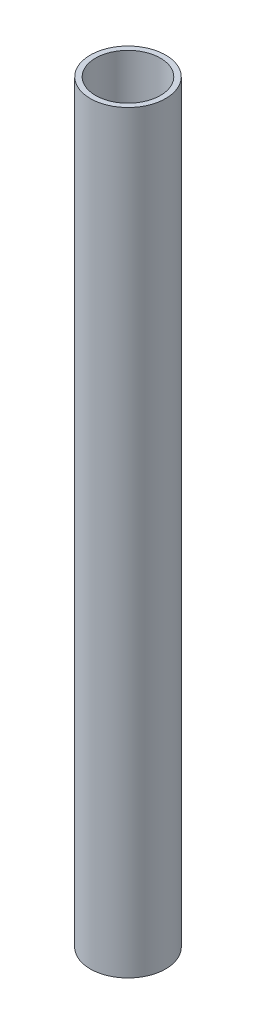
from build123d import *

# Parameters (mm, degrees)
SKETCH1_R           = 6.35
BOSS_EXTRUDE1_DEPTH = 127
SKETCH2_R           = 5.461
CUT_EXTRUDE3_DEPTH  = 127


with BuildPart() as part:
    # Sketch1 → Boss-Extrude1 (new body)
    with BuildSketch(Plane(origin=(0, 0, 0), x_dir=(1, 0, 0), z_dir=(0, 1, 0))):
        with Locations(Location((0, 0, 0), (0, 0, 270))):
            Circle(SKETCH1_R)
    extrude(amount=BOSS_EXTRUDE1_DEPTH)

    # Sketch2 → Cut-Extrude3 (cut)
    with BuildSketch(Plane(origin=(0, 127, 0), x_dir=(1, 0, 0), z_dir=(0, 1, 0))):
        with Locations(Location((0, 0, 0), (0, 0, 270))):
            Circle(SKETCH2_R)
    extrude(amount=-CUT_EXTRUDE3_DEPTH, mode=Mode.SUBTRACT)


solid = part.part
